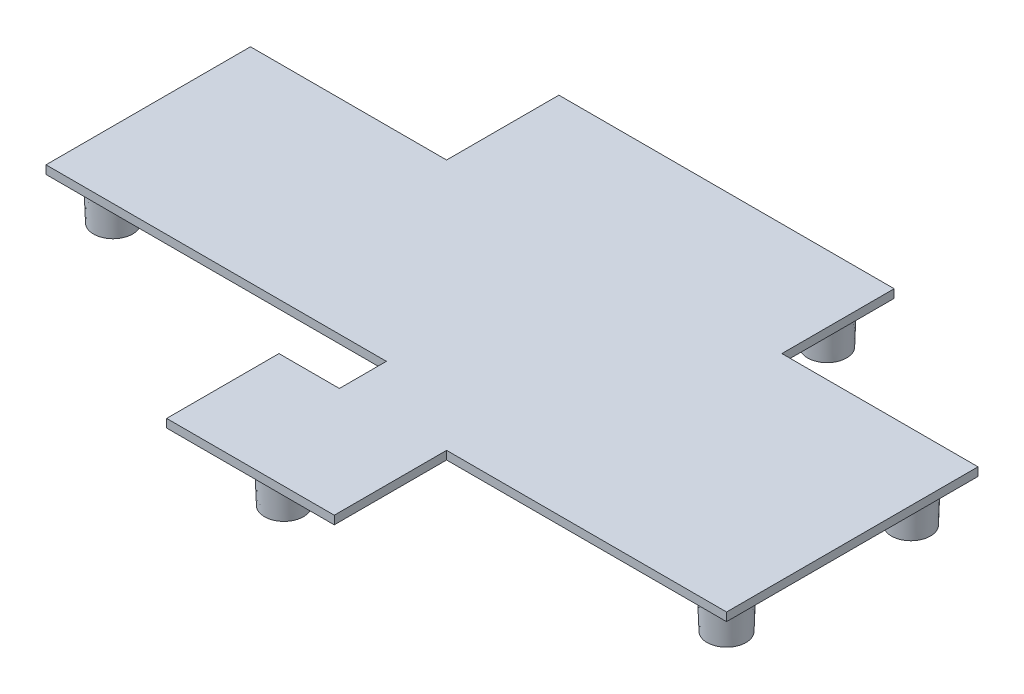
from build123d import *

# Parameters (mm, degrees)
BOSS_EXTRUDE1_DEPTH           = 1
SKETCH3_W                     = 10
SKETCH3_H                     = 13.4
CUT_EXTRUDE1_DEPTH            = 98.050502317
SKETCH4_W                     = 60
SKETCH4_H                     = 1.5
BOSS_EXTRUDE3_DEPTH           = 3
SKETCH5_R                     = 2.5
BOSS_EXTRUDE4_DEPTH           = 5
BOSS_EXTRUDE4_DRAFT           = 2
BOSS_EXTRUDE4_PROFILE_2_DEPTH = 5
BOSS_EXTRUDE4_PROFILE_2_DRAFT = 2
BOSS_EXTRUDE4_PROFILE_3_DEPTH = 5
BOSS_EXTRUDE4_PROFILE_3_DRAFT = 2
BOSS_EXTRUDE4_PROFILE_4_DEPTH = 5
BOSS_EXTRUDE4_PROFILE_4_DRAFT = 2
BOSS_EXTRUDE4_PROFILE_5_DEPTH = 5
BOSS_EXTRUDE4_PROFILE_5_DRAFT = 2
BOSS_EXTRUDE4_PROFILE_6_DEPTH = 5
BOSS_EXTRUDE4_PROFILE_6_DRAFT = 2
BOSS_EXTRUDE4_PROFILE_7_DEPTH = 5
BOSS_EXTRUDE4_PROFILE_7_DRAFT = 2


with BuildPart() as part:
    # Sketch1 → Boss-Extrude1 (new body)
    with BuildSketch(Plane(origin=(0, 0, 0), x_dir=(1, 0, 0), z_dir=(0, 1, 0))):
        Polygon((63.4, 30), (86.8, 30), (86.8, 0), (63.4, 0), (63.4, -13.4), (23.4, -13.4), (23.4, 0), (0, 0), (0, 30), (23.4, 30), (23.4, 43.4), (63.4, 43.4), align=None)
    extrude(amount=BOSS_EXTRUDE1_DEPTH)

    # Sketch3 → Cut-Extrude1 (cut, through all)
    with BuildSketch(Plane(origin=(0, 1, 0), x_dir=(1, 0, 0), z_dir=(0, 1, 0))):
        Polygon((0, 0), (23.4, 0), (33.4, 0), (40.609890906, 0), (40.609890906, 5.606324955), (0, 5.606324955), align=None)
        with Locations((28.4, -6.7)):
            Rectangle(SKETCH3_W, SKETCH3_H)
        with Locations((58.4, -6.7)):
            Rectangle(SKETCH3_W, SKETCH3_H)
    extrude(amount=-CUT_EXTRUDE1_DEPTH, mode=Mode.SUBTRACT)

    # Sketch4 → Boss-Extrude3 (add)
    with BuildSketch(Plane.XZ):
        with Locations((43.4, -15.25)):
            Rectangle(SKETCH4_W, SKETCH4_H)
        with Locations((43.4, -10.75)):
            Rectangle(SKETCH4_W, SKETCH4_H)
        with Locations((43.4, -19.75)):
            Rectangle(SKETCH4_W, SKETCH4_H)
        with Locations((43.4, -24.25)):
            Rectangle(SKETCH4_W, SKETCH4_H)
    extrude(amount=BOSS_EXTRUDE3_DEPTH)


with BuildPart() as boss_extrude4_tool:
    # Sketch5 → Boss-Extrude4 (with draft: the straight prism first)
    with BuildSketch(Plane(origin=(0, 0, 0), x_dir=(-1, 0, 0), z_dir=(0, -1, 0))):
        with Locations((-4, 9.606324955)):
            Circle(SKETCH5_R)
    extrude(amount=BOSS_EXTRUDE4_DEPTH)
    # Boss-Extrude4: the draft: its side faces are tilted about the plane it starts from
    boss_extrude4_sides = [boss_extrude4_tool.faces().sort_by_distance(p)[0] for p in [
        (6.5, -2.5, -9.606324955),
    ]]
    draft(boss_extrude4_sides, Plane(origin=(0, 0, 0), x_dir=(-1, 0, 0), z_dir=(0, -1, 0)), BOSS_EXTRUDE4_DRAFT)


with BuildPart() as part_1:
    add(part.part)

    # Boss-Extrude4: add boss_extrude4_tool
    add(boss_extrude4_tool.part)


with BuildPart() as boss_extrude4_profile_2_tool:
    # Sketch5 → Boss-Extrude4 profile 2 (with draft: the straight prism first)
    with BuildSketch(Plane(origin=(0, 0, 0), x_dir=(-1, 0, 0), z_dir=(0, -1, 0))):
        with Locations((-4, 26)):
            Circle(SKETCH5_R)
    extrude(amount=BOSS_EXTRUDE4_PROFILE_2_DEPTH)
    # Boss-Extrude4 profile 2: the draft: its side faces are tilted about the plane it starts from
    boss_extrude4_profile_2_sides = [boss_extrude4_profile_2_tool.faces().sort_by_distance(p)[0] for p in [
        (6.5, -2.5, -26),
    ]]
    draft(boss_extrude4_profile_2_sides, Plane(origin=(0, 0, 0), x_dir=(-1, 0, 0), z_dir=(0, -1, 0)), BOSS_EXTRUDE4_PROFILE_2_DRAFT)


with BuildPart() as part_2:
    add(part_1.part)

    # Boss-Extrude4 profile 2: add boss_extrude4_profile_2_tool
    add(boss_extrude4_profile_2_tool.part)


with BuildPart() as boss_extrude4_profile_3_tool:
    # Sketch5 → Boss-Extrude4 profile 3 (with draft: the straight prism first)
    with BuildSketch(Plane(origin=(0, 0, 0), x_dir=(-1, 0, 0), z_dir=(0, -1, 0))):
        with Locations((-82.8, 26)):
            Circle(SKETCH5_R)
    extrude(amount=BOSS_EXTRUDE4_PROFILE_3_DEPTH)
    # Boss-Extrude4 profile 3: the draft: its side faces are tilted about the plane it starts from
    boss_extrude4_profile_3_sides = [boss_extrude4_profile_3_tool.faces().sort_by_distance(p)[0] for p in [
        (85.3, -2.5, -26),
    ]]
    draft(boss_extrude4_profile_3_sides, Plane(origin=(0, 0, 0), x_dir=(-1, 0, 0), z_dir=(0, -1, 0)), BOSS_EXTRUDE4_PROFILE_3_DRAFT)


with BuildPart() as part_3:
    add(part_2.part)

    # Boss-Extrude4 profile 3: add boss_extrude4_profile_3_tool
    add(boss_extrude4_profile_3_tool.part)


with BuildPart() as boss_extrude4_profile_4_tool:
    # Sketch5 → Boss-Extrude4 profile 4 (with draft: the straight prism first)
    with BuildSketch(Plane(origin=(0, 0, 0), x_dir=(-1, 0, 0), z_dir=(0, -1, 0))):
        with Locations((-82.8, 4)):
            Circle(SKETCH5_R)
    extrude(amount=BOSS_EXTRUDE4_PROFILE_4_DEPTH)
    # Boss-Extrude4 profile 4: the draft: its side faces are tilted about the plane it starts from
    boss_extrude4_profile_4_sides = [boss_extrude4_profile_4_tool.faces().sort_by_distance(p)[0] for p in [
        (85.3, -2.5, -4),
    ]]
    draft(boss_extrude4_profile_4_sides, Plane(origin=(0, 0, 0), x_dir=(-1, 0, 0), z_dir=(0, -1, 0)), BOSS_EXTRUDE4_PROFILE_4_DRAFT)


with BuildPart() as part_4:
    add(part_3.part)

    # Boss-Extrude4 profile 4: add boss_extrude4_profile_4_tool
    add(boss_extrude4_profile_4_tool.part)


with BuildPart() as boss_extrude4_profile_5_tool:
    # Sketch5 → Boss-Extrude4 profile 5 (with draft: the straight prism first)
    with BuildSketch(Plane(origin=(0, 0, 0), x_dir=(-1, 0, 0), z_dir=(0, -1, 0))):
        with Locations((-59.4, 39.4)):
            Circle(SKETCH5_R)
    extrude(amount=BOSS_EXTRUDE4_PROFILE_5_DEPTH)
    # Boss-Extrude4 profile 5: the draft: its side faces are tilted about the plane it starts from
    boss_extrude4_profile_5_sides = [boss_extrude4_profile_5_tool.faces().sort_by_distance(p)[0] for p in [
        (61.9, -2.5, -39.4),
    ]]
    draft(boss_extrude4_profile_5_sides, Plane(origin=(0, 0, 0), x_dir=(-1, 0, 0), z_dir=(0, -1, 0)), BOSS_EXTRUDE4_PROFILE_5_DRAFT)


with BuildPart() as part_5:
    add(part_4.part)

    # Boss-Extrude4 profile 5: add boss_extrude4_profile_5_tool
    add(boss_extrude4_profile_5_tool.part)


with BuildPart() as boss_extrude4_profile_6_tool:
    # Sketch5 → Boss-Extrude4 profile 6 (with draft: the straight prism first)
    with BuildSketch(Plane(origin=(0, 0, 0), x_dir=(-1, 0, 0), z_dir=(0, -1, 0))):
        with Locations((-27.4, 39.4)):
            Circle(SKETCH5_R)
    extrude(amount=BOSS_EXTRUDE4_PROFILE_6_DEPTH)
    # Boss-Extrude4 profile 6: the draft: its side faces are tilted about the plane it starts from
    boss_extrude4_profile_6_sides = [boss_extrude4_profile_6_tool.faces().sort_by_distance(p)[0] for p in [
        (29.9, -2.5, -39.4),
    ]]
    draft(boss_extrude4_profile_6_sides, Plane(origin=(0, 0, 0), x_dir=(-1, 0, 0), z_dir=(0, -1, 0)), BOSS_EXTRUDE4_PROFILE_6_DRAFT)


with BuildPart() as part_6:
    add(part_5.part)

    # Boss-Extrude4 profile 6: add boss_extrude4_profile_6_tool
    add(boss_extrude4_profile_6_tool.part)


with BuildPart() as boss_extrude4_profile_7_tool:
    # Sketch5 → Boss-Extrude4 profile 7 (with draft: the straight prism first)
    with BuildSketch(Plane(origin=(0, 0, 0), x_dir=(-1, 0, 0), z_dir=(0, -1, 0))):
        with Locations((-43.4, -9.4)):
            Circle(SKETCH5_R)
    extrude(amount=BOSS_EXTRUDE4_PROFILE_7_DEPTH)
    # Boss-Extrude4 profile 7: the draft: its side faces are tilted about the plane it starts from
    boss_extrude4_profile_7_sides = [boss_extrude4_profile_7_tool.faces().sort_by_distance(p)[0] for p in [
        (45.9, -2.5, 9.4),
    ]]
    draft(boss_extrude4_profile_7_sides, Plane(origin=(0, 0, 0), x_dir=(-1, 0, 0), z_dir=(0, -1, 0)), BOSS_EXTRUDE4_PROFILE_7_DRAFT)


with BuildPart() as part_7:
    add(part_6.part)

    # Boss-Extrude4 profile 7: add boss_extrude4_profile_7_tool
    add(boss_extrude4_profile_7_tool.part)


solid = part_7.part
